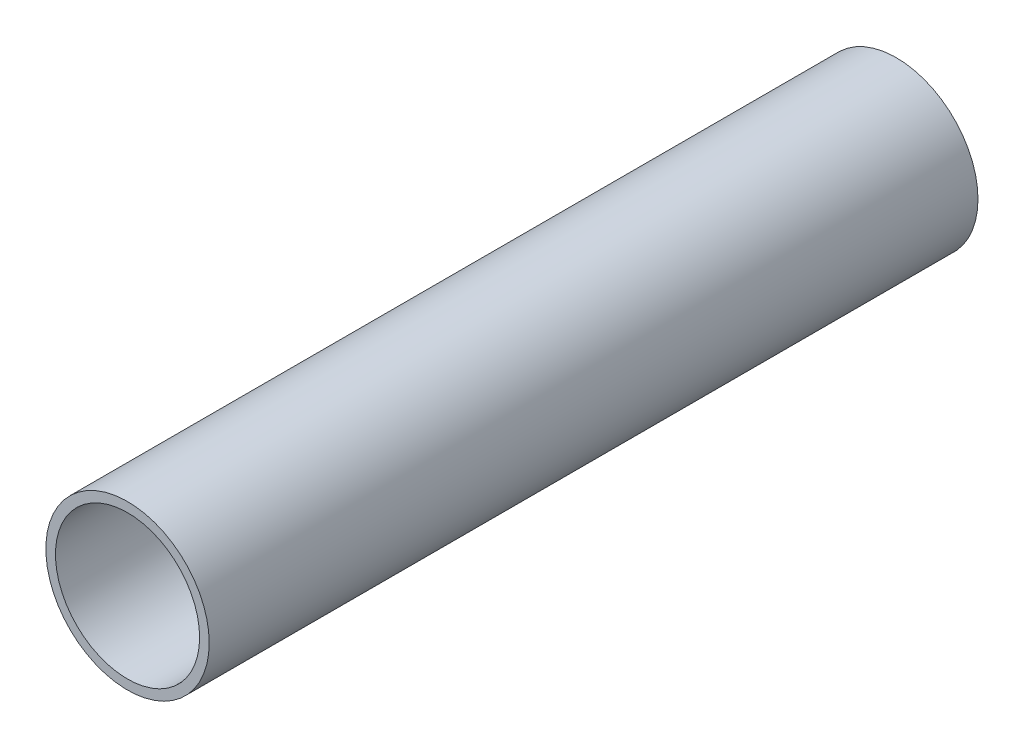
from build123d import *

# Parameters (mm, degrees)
SKETCH1_R           = 42.5
SKETCH1_R_2         = 37.5
BOSS_EXTRUDE1_DEPTH = 400


with BuildPart() as part:
    # Sketch1 → Boss-Extrude1 (new body)
    with BuildSketch(Plane.XY):
        Circle(SKETCH1_R)
        Circle(SKETCH1_R_2, mode=Mode.SUBTRACT)
    extrude(amount=BOSS_EXTRUDE1_DEPTH)


solid = part.part
